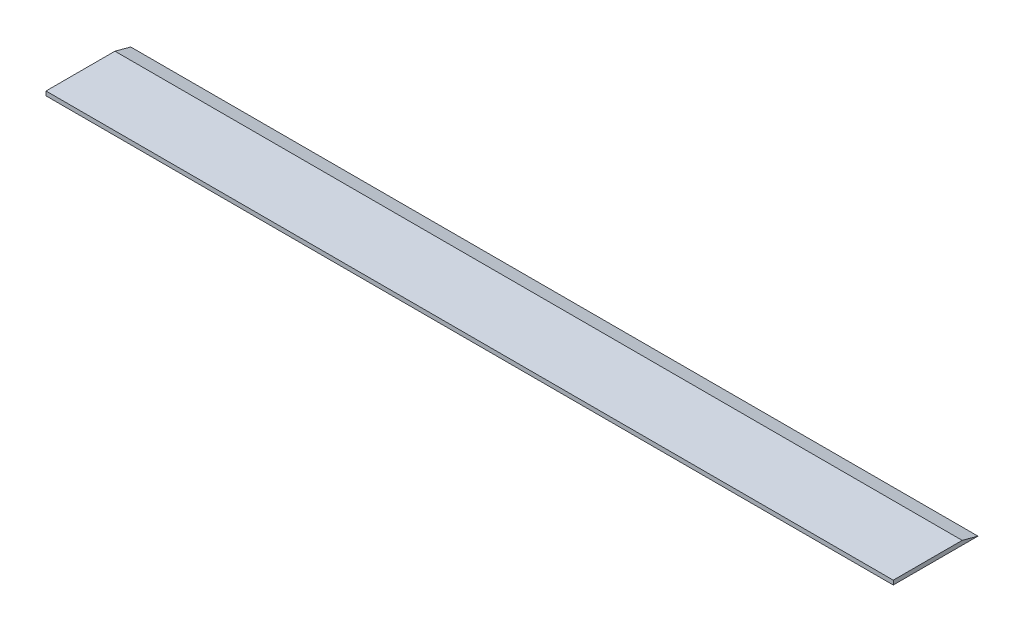
from build123d import *

# Parameters (mm, degrees)
SKETCH1_W          = 200
SKETCH1_H          = 20
BLADE_DEPTH        = 1
CUT_EXTRUDE1_DEPTH = 201.25234081


with BuildPart() as part:
    # Sketch1 → Blade (new body)
    with BuildSketch(Plane(origin=(0, 0, 0), x_dir=(1, 0, 0), z_dir=(0, 1, 0))):
        Rectangle(SKETCH1_W, SKETCH1_H)
    extrude(amount=BLADE_DEPTH)

    # Sketch2 → Cut-Extrude1 (cut, through all)
    with BuildSketch(Plane(origin=(100, 0, 0), x_dir=(0, 0, -1), z_dir=(1, 0, 0))):
        Polygon((10, 1), (6.267949192, 1), (10, 0), align=None)
    extrude(amount=-CUT_EXTRUDE1_DEPTH, mode=Mode.SUBTRACT)


solid = part.part
